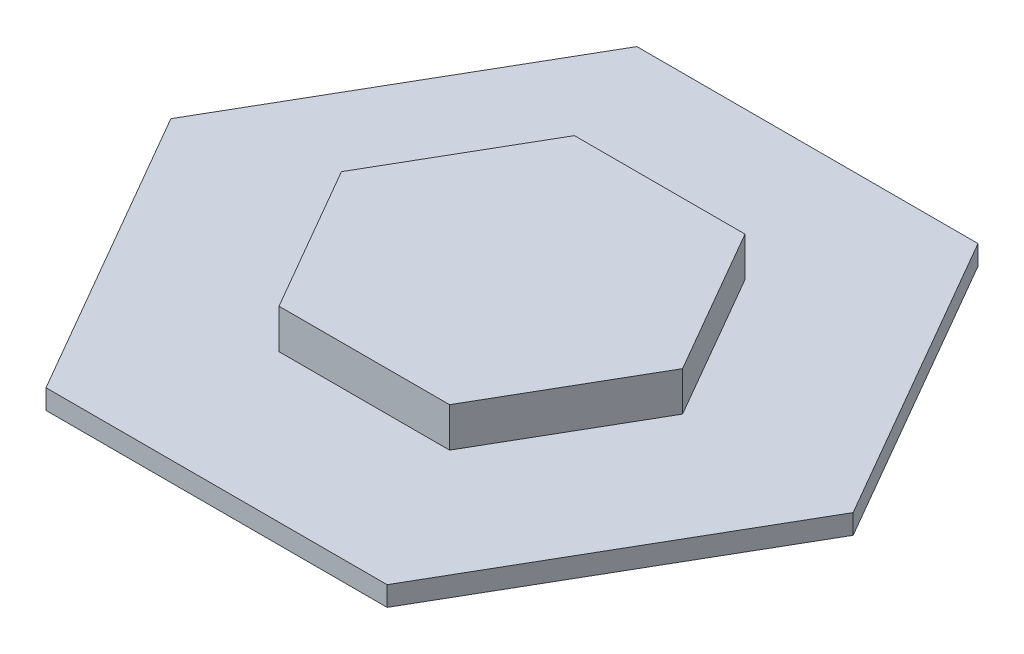
from build123d import *

# Parameters (mm, degrees)
BOSS_EXTRUDE1_DEPTH = 1
BOSS_EXTRUDE2_DEPTH = 3


with BuildPart() as part:
    # Sketch2 → Boss-Extrude1 (new body)
    with BuildSketch(Plane(origin=(0, 0, 0), x_dir=(1, 0, 0), z_dir=(0, 1, 0))):
        Polygon((17.320508076, 0), (8.660254038, 15), (-8.660254038, 15), (-17.320508076, 0), (-8.660254038, -15), (8.660254038, -15), align=None)
        Polygon((8.660254038, 0), (4.330127019, 7.5), (-4.330127019, 7.5), (-8.660254038, 0), (-4.330127019, -7.5), (4.330127019, -7.5), align=None, mode=Mode.SUBTRACT)
    extrude(amount=BOSS_EXTRUDE1_DEPTH)

    # Sketch2<2> → Boss-Extrude2 (add)
    with BuildSketch(Plane(origin=(0, 0, 0), x_dir=(1, 0, 0), z_dir=(0, 1, 0))):
        Polygon((4.330127019, -7.5), (8.660254038, 0), (4.330127019, 7.5), (-4.330127019, 7.5), (-8.660254038, 0), (-4.330127019, -7.5), align=None)
    extrude(amount=BOSS_EXTRUDE2_DEPTH)


solid = part.part
